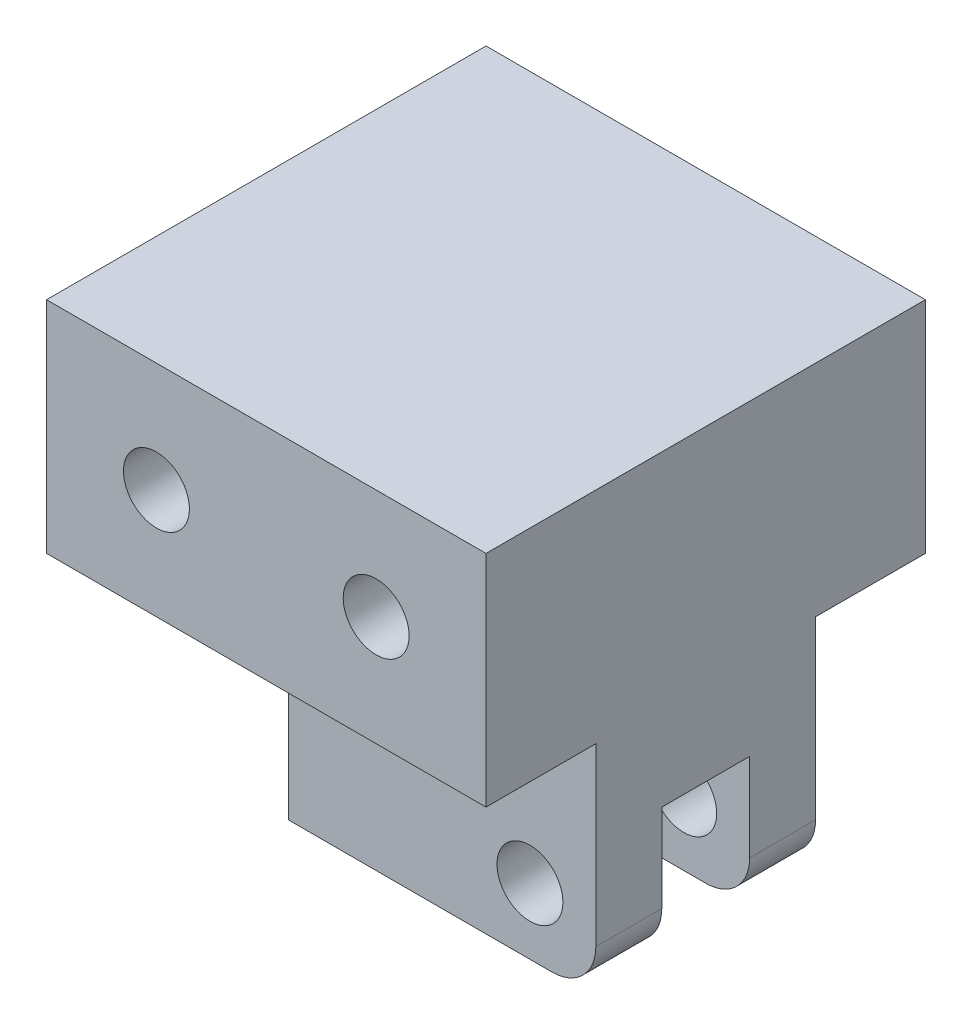
from build123d import *

# Parameters (mm, degrees)
SKETCH1_W           = 100
SKETCH1_H           = 50
BOSS_EXTRUDE1_DEPTH = 100
SKETCH2_R           = 7.5
CUT_EXTRUDE1_DEPTH  = 151
SKETCH3_W           = 70
SKETCH3_H           = 50
BOSS_EXTRUDE2_DEPTH = 50
SKETCH4_R           = 7.5
CUT_EXTRUDE2_DEPTH  = 135.629120178
SKETCH5_W           = 30
SKETCH5_H           = 20
CUT_EXTRUDE3_DEPTH  = 30
FILLET1_R           = 10


with BuildPart() as part:
    # Sketch1 → Boss-Extrude1 (new body)
    with BuildSketch(Plane(origin=(0, 0, 0), x_dir=(0, 0, -1), z_dir=(1, 0, 0))):
        with Locations((-50, 25)):
            Rectangle(SKETCH1_W, SKETCH1_H)
    extrude(amount=BOSS_EXTRUDE1_DEPTH)

    # Sketch2 → Cut-Extrude1 (cut, through all)
    with BuildSketch(Plane(origin=(0, 0, 0), x_dir=(-1, 0, 0), z_dir=(0, 0, -1))):
        with Locations(Location((-75, 25, 0), (0, 0, 90))):
            Circle(SKETCH2_R)
        with Locations(Location((-25, 25, 0), (0, 0, 90))):
            Circle(SKETCH2_R)
    extrude(amount=-CUT_EXTRUDE1_DEPTH, mode=Mode.SUBTRACT)

    # Sketch3 → Boss-Extrude2 (add)
    with BuildSketch(Plane.XZ):
        with Locations((65, 50)):
            Rectangle(SKETCH3_W, SKETCH3_H)
    extrude(amount=BOSS_EXTRUDE2_DEPTH)

    # Sketch4 → Cut-Extrude2 (cut, through all)
    with BuildSketch(Plane.XY.offset(75)):
        with Locations((85, -35)):
            Circle(SKETCH4_R)
    extrude(amount=-CUT_EXTRUDE2_DEPTH, mode=Mode.SUBTRACT)

    # Sketch5 → Cut-Extrude3 (cut)
    with BuildSketch(Plane.XZ.offset(50)):
        with Locations((85, 50)):
            Rectangle(SKETCH5_W, SKETCH5_H)
    extrude(amount=-CUT_EXTRUDE3_DEPTH, mode=Mode.SUBTRACT)

    # Fillet1
    fillet1_edges = [part.edges().sort_by_distance(p)[0] for p in [
        (100, -50, 32.5),
        (100, -50, 67.5),
        (70, -20, 50),
    ]]
    fillet(fillet1_edges, radius=FILLET1_R)


solid = part.part
